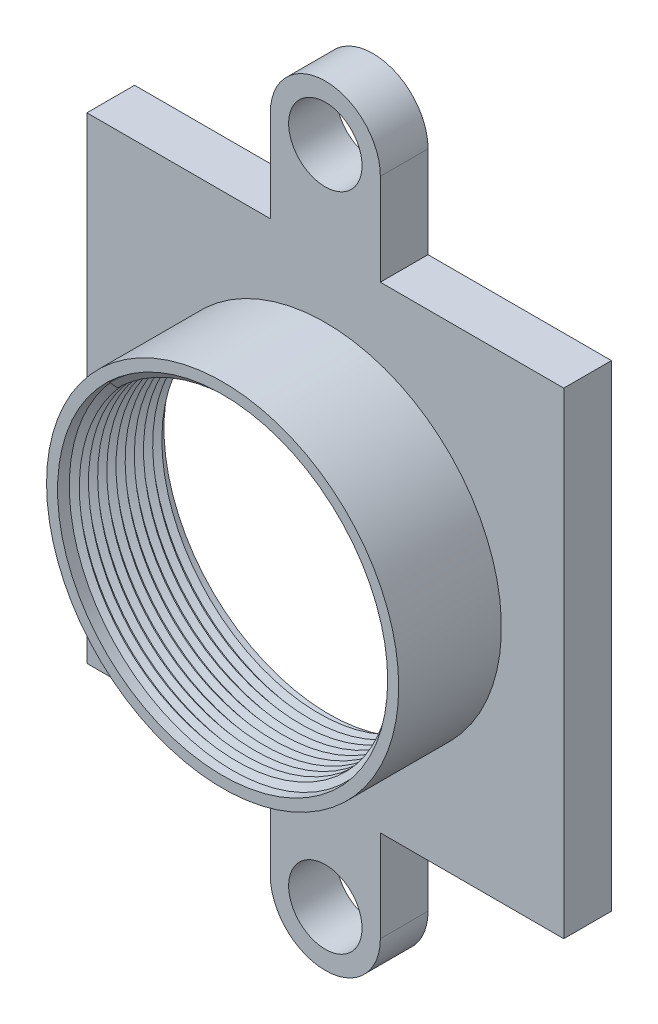
from build123d import *

# Parameters (mm, degrees)
SKETCH_1_W          = 13
SKETCH_1_H          = 13
SKETCH_1_W_2        = 12
SKETCH_1_H_2        = 12
EXTRUDE_1_DEPTH     = 1.2
SKETCH_2_W          = 13
SKETCH_2_H          = 13
SKETCH_2_R          = 4.5
EXTRUDE_2_DEPTH     = 0.1
SKETCH_3_W          = 3
SKETCH_3_H          = 1.3
EXTRUDE_3_DEPTH     = 4
CUT_EXTRUDE_1_DEPTH = 4
SKETCH_5_R          = 1
CUT_EXTRUDE_2_DEPTH = 4
SKETCH_6_R          = 4.8
SKETCH_6_R_2        = 4.5
EXTRUDE_4_DEPTH     = 2.8
SWEEP_1_PITCH       = 0.25
SWEEP_1_HEIGHT      = 2.625
SWEEP_1_RADIUS      = 4.5
SWEEP_1_START_ANGLE = -45


with BuildPart() as part:
    # 草图1 → 凸台-拉伸1 (new body)
    with BuildSketch(Plane.XY):
        Rectangle(SKETCH_1_W, SKETCH_1_H)
        Rectangle(SKETCH_1_W_2, SKETCH_1_H_2, mode=Mode.SUBTRACT)
    extrude(amount=EXTRUDE_1_DEPTH)

    # 草图2 → 凸台-拉伸2 (add)
    with BuildSketch(Plane.XY.offset(1.2)):
        Rectangle(SKETCH_2_W, SKETCH_2_H)
        Circle(SKETCH_2_R, mode=Mode.SUBTRACT)
    extrude(amount=EXTRUDE_2_DEPTH)

    # 草图3 → 凸台-拉伸3 (add)
    with BuildSketch(Plane(origin=(0, 6.5, 0), x_dir=(1, 0, 0), z_dir=(0, 1, 0))):
        with Locations((0, -0.65)):
            Rectangle(SKETCH_3_W, SKETCH_3_H)
    extrude_3 = extrude(amount=EXTRUDE_3_DEPTH)

    # 草图4 → 切除-拉伸1 (cut)
    with BuildSketch(Plane.XY.offset(1.3)):
        with BuildLine():
            Line((-1.5, 10.5), (-1.5, 9))
            ThreePointArc((-1.5, 9), (-1.060660172, 10.060660172), (0, 10.5))
            Line((0, 10.5), (-1.5, 10.5))
        make_face()
        with BuildLine():
            ThreePointArc((0, 10.5), (1.060660172, 10.060660172), (1.5, 9))
            Line((1.5, 9), (1.5, 10.5))
            Line((1.5, 10.5), (0, 10.5))
        make_face()
    cut_extrude_1 = extrude(amount=-CUT_EXTRUDE_1_DEPTH, mode=Mode.SUBTRACT)

    # 草图5 → 切除-拉伸2 (cut)
    with BuildSketch(Plane.XY.offset(1.3)):
        with Locations((0, 9)):
            Circle(SKETCH_5_R)
    cut_extrude_2 = extrude(amount=-CUT_EXTRUDE_2_DEPTH, mode=Mode.SUBTRACT)

    # 镜向1: 凸台-拉伸3, 切除-拉伸1, 切除-拉伸2 across plane
    add(extrude_3.mirror(Plane.ZX))
    add(cut_extrude_1.mirror(Plane.ZX), mode=Mode.SUBTRACT)
    add(cut_extrude_2.mirror(Plane.ZX), mode=Mode.SUBTRACT)

    # 草图6 → 凸台-拉伸4 (add)
    with BuildSketch(Plane.XY.offset(1.3)):
        with Locations(Location((0, 0, 0), (0, 0, 180))):
            Circle(SKETCH_6_R)
        Circle(SKETCH_6_R_2, mode=Mode.SUBTRACT)
    extrude(amount=EXTRUDE_4_DEPTH)


with BuildPart() as body_2:
    # 扫描1: sweep along a helix
    with BuildLine() as sweep_1_path:
        add(Helix(SWEEP_1_PITCH, SWEEP_1_HEIGHT, SWEEP_1_RADIUS, center=(0, 0, 1.2), direction=(0, 0, 1), mode=Mode.PRIVATE).rotate(Axis((0, 0, 1.2), (0, 0, 1)), SWEEP_1_START_ANGLE))
    # 草图8 → 扫描1 (sweep)
    with BuildSketch(Plane(origin=(0, 0, 0), x_dir=(1, 0, 0), z_dir=(0, 1, 0))):
        Polygon((-4.477344788, -1.602270081), (-4.477344788, -1.802270081), (-4.304139707, -1.702270081), align=None)
    sweep(path=sweep_1_path.line, is_frenet=True)


solid = Compound([part.part, body_2.part])
